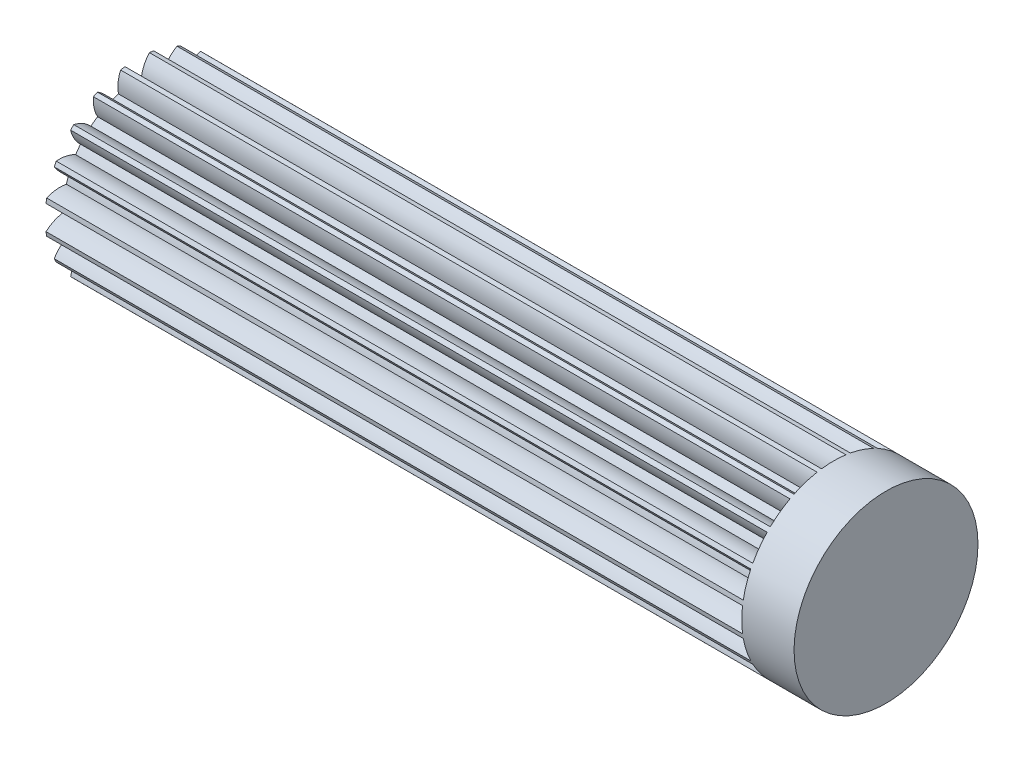
from build123d import *

# Parameters (mm, degrees)
BASPROSKE_W         = 166.593250705
BASPROSKE_H         = 22
TOOTHCUT_DEPTH      = 170.47362975
TEETHCUTS_COUNT     = 20
TEETHCUTS_ANGLE     = 342
BORSKE_R            = 0.4
BORE_DEPTH          = 50.0000508
SCALE1_SCALE        = 0.399751684
SKETCH3_R           = 2.5
CUT_EXTRUDE3_DEPTH  = 2
CUT_EXTRUDE4_DEPTH  = 19.8
BOSS_EXTRUDE1_START = 5
SKETCH5_R           = 8.794537041
BOSS_EXTRUDE1_DEPTH = 5


with BuildPart() as part:
    # BasProSke → Base-Revolve (revolve)
    with BuildSketch(Plane(origin=(0, 0, 0), x_dir=(1, 0, 0), z_dir=(0, 1, 0)), mode=Mode.PRIVATE) as base_revolve_sk:
        with Locations((83.296625353, 11)):
            Rectangle(BASPROSKE_W, BASPROSKE_H)
    revolve(base_revolve_sk.sketch.rotate(Axis((-10, 0, 0), (1, 0, 0)), 180), axis=Axis((-10, 0, 0), (1, 0, 0)))

    # TooCutSke → ToothCut (cut, through all)
    with BuildSketch(Plane(origin=(0, 0, 0), x_dir=(0, 0, -1), z_dir=(1, 0, 0))):
        with BuildLine():
            ThreePointArc((0.986171591, 17.471189616), (0, 17.499), (-0.986171591, 17.471189616))
            ThreePointArc((-0.986171591, 17.471189616), (-1.626916196, 19.798789858), (-2.932850173, 21.829260982))
            ThreePointArc((-2.932850173, 21.829260982), (0, 22.0254), (2.932850173, 21.829260982))
            ThreePointArc((2.932850173, 21.829260982), (1.626916196, 19.798789858), (0.986171591, 17.471189616))
        make_face()
    toothcut = extrude(amount=TOOTHCUT_DEPTH, mode=Mode.SUBTRACT)

    # TeethCuts: ToothCut ×20 about axis
    teethcuts_axis = Axis((-10, 0, 0), (1, 0, 0))
    for i in range(1, TEETHCUTS_COUNT):
        add(toothcut.rotate(teethcuts_axis, i * TEETHCUTS_ANGLE / (TEETHCUTS_COUNT - 1)), mode=Mode.SUBTRACT)

    # BorSke → Bore (cut, symmetric)
    with BuildSketch(Plane(origin=(0, 0, 0), x_dir=(0, 0, -1), z_dir=(1, 0, 0))):
        Circle(BORSKE_R)
    extrude(amount=BORE_DEPTH, both=True, mode=Mode.SUBTRACT)


with BuildPart() as part_1:
    # Scale1: scaled about (83.303871456, 0, 0)
    add(part.part.scale(SCALE1_SCALE).moved(Location((50.003008586, 0, 0))))

    # Sketch3 → Cut-Extrude3 (cut)
    with BuildSketch(Plane.ZY.offset(-50.003008586)):
        Circle(SKETCH3_R)
    extrude(amount=-CUT_EXTRUDE3_DEPTH, mode=Mode.SUBTRACT)

    # Sketch4 → Cut-Extrude4 (cut)
    with BuildSketch(Plane.ZY.offset(-52.003008586)):
        with BuildLine():
            Line((2.234682225, 1.120801211), (1.701680185, -1.831470597))
            ThreePointArc((1.701680185, -1.831470597), (-2.460226506, 0.444168366), (2.234682225, 1.120801211))
        make_face()
    extrude(amount=-CUT_EXTRUDE4_DEPTH, mode=Mode.SUBTRACT)

    # Sketch5 → Boss-Extrude1 (add)
    with BuildSketch(Plane(origin=(116.598941042, 0, 0), x_dir=(0, 0, -1), z_dir=(1, 0, 0)).offset(BOSS_EXTRUDE1_START)):
        with Locations(Location((0, 0, 0), (0, 0, 172.391971096))):
            Circle(SKETCH5_R)
    extrude(amount=-BOSS_EXTRUDE1_DEPTH)


solid = part_1.part
